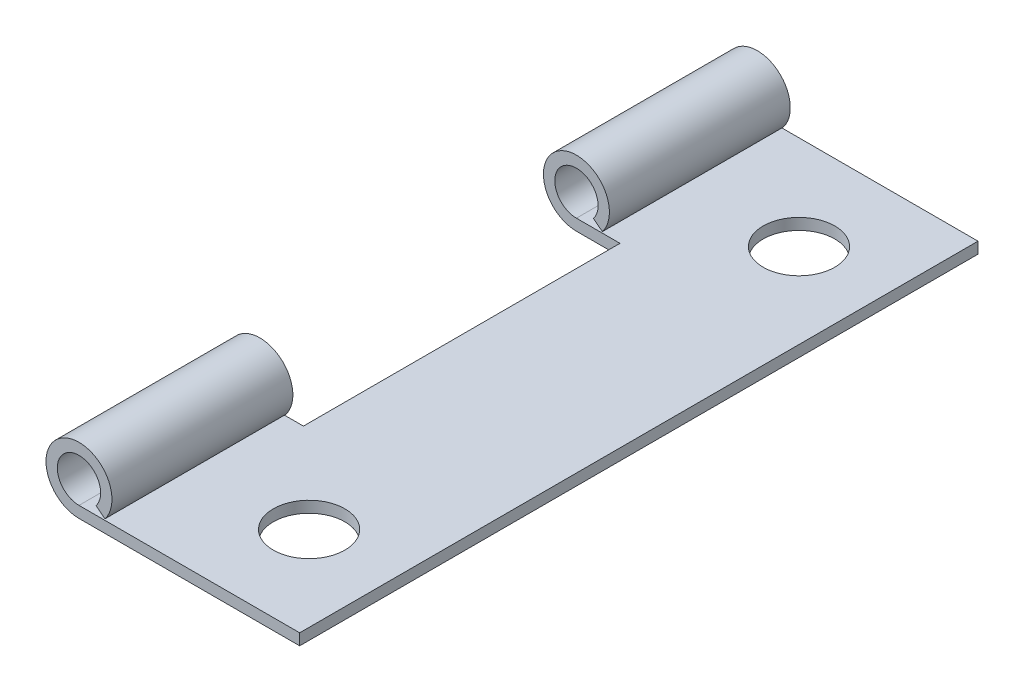
from build123d import *

# Parameters (mm, degrees)
BOSS_EXTRUDE1_DEPTH     = 36
SKETCH2_R               = 1.9
CUT_EXTRUDE1_DEPTH      = 39.543989963
CUT_EXTRUDE2_DEPTH      = 39.543989963
CUT_EXTRUDE2_DEPTH_BACK = 39.543989963
SKETCH3_W               = 8.124276203
SKETCH3_H               = 16.8


with BuildPart() as part:
    # Sketch1 → Boss-Extrude1 (new body)
    with BuildSketch(Plane.XY):
        with BuildLine():
            Line((0, 0), (0, 0.6))
            Line((0, 0.6), (-11.712138102, 0.6))
            ThreePointArc((-11.712138102, 0.6), (-12.215259426, 2.784102961), (-10.807304622, 1.040227943))
            Line((-10.807304622, 1.040227943), (-10.335217589, 0.669912086))
            ThreePointArc((-10.335217589, 0.669912086), (-12.477757508, 3.32363494), (-11.712138102, 0))
            Line((-11.712138102, 0), (0, 0))
        make_face()
    extrude(amount=BOSS_EXTRUDE1_DEPTH)

    # Sketch2 → Cut-Extrude1 (cut, through all)
    with BuildSketch(Plane(origin=(0, 0.6, 0), x_dir=(1, 0, 0), z_dir=(0, 1, 0))):
        with Locations(Location((-4.5, -5, 0), (0, 0, 180))):
            Circle(SKETCH2_R)
        with Locations(Location((-4.5, -31, 0), (0, 0, 180))):
            Circle(SKETCH2_R)
    extrude(amount=-CUT_EXTRUDE1_DEPTH, mode=Mode.SUBTRACT)

    # Sketch3 → Cut-Extrude2 (cut, two sides: drawn at the far end of the back side and taken through both)
    with BuildSketch(Plane(origin=(0, 0.6, 0), x_dir=(1, 0, 0), z_dir=(0, 1, 0)).offset(-CUT_EXTRUDE2_DEPTH_BACK)):
        with Locations((-13.462138101, -18)):
            Rectangle(SKETCH3_W, SKETCH3_H)
    extrude(amount=CUT_EXTRUDE2_DEPTH + CUT_EXTRUDE2_DEPTH_BACK, mode=Mode.SUBTRACT)


solid = part.part
